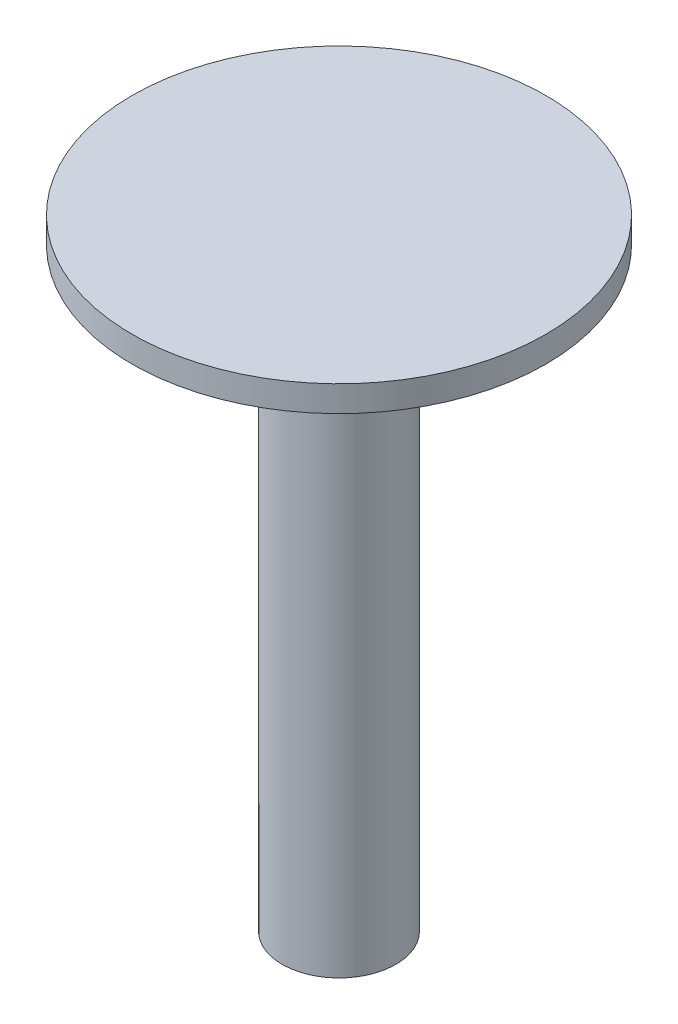
from build123d import *

# Parameters (mm, degrees)
FILLET1_R = 2


with BuildPart() as part:
    # Sketch3 → Revolve1 (revolve)
    with BuildSketch(Plane.XY, mode=Mode.PRIVATE) as revolve1_sk:
        Polygon((0, 120), (0, 0), (11, 0), (11, 115), (40, 115), (40, 120), align=None)
    revolve(revolve1_sk.sketch.rotate(Axis((0, 120, 0), (0, -1, 0)), 180), axis=Axis((0, 120, 0), (0, -1, 0)))

    # Fillet1
    fillet1_edges = [part.edges().sort_by_distance(p)[0] for p in [
        (11, 115, 0),
    ]]
    fillet(fillet1_edges, radius=FILLET1_R)


solid = part.part
